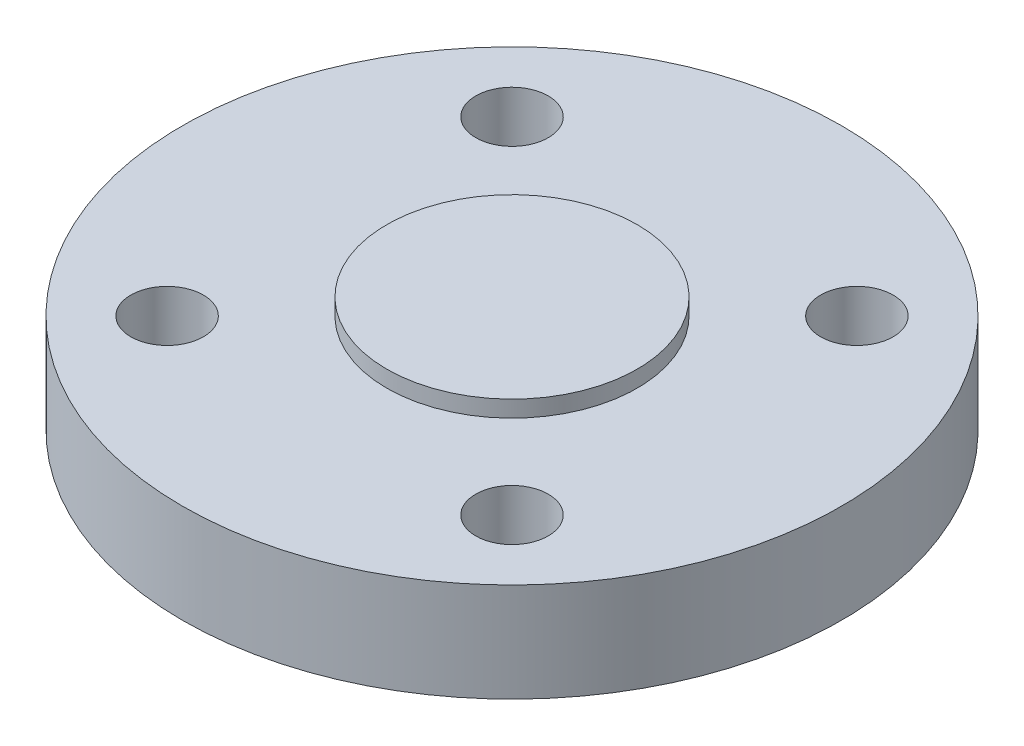
from build123d import *

# Parameters (mm, degrees)
SKETCH_1_R               = 50
EXTRUDE_1_DEPTH          = 15
SKETCH_2_R               = 19
EXTRUDE_2_DEPTH          = 2.5
CUT_EXTRUDE_1_DEPTH      = 73.284161474
CUT_EXTRUDE_1_DEPTH_BACK = 73.284161474
SKETCH_3_R               = 5.5


with BuildPart() as part:
    # 草图1 → 凸台-拉伸1 (new body)
    with BuildSketch(Plane(origin=(0, 0, 0), x_dir=(1, 0, 0), z_dir=(0, 1, 0))):
        with Locations(Location((0, 0, 0), (0, 0, 270))):
            Circle(SKETCH_1_R)
    extrude(amount=EXTRUDE_1_DEPTH)

    # 草图2 → 凸台-拉伸2 (add)
    with BuildSketch(Plane(origin=(0, 15, 0), x_dir=(1, 0, 0), z_dir=(0, 1, 0))):
        with Locations(Location((0, 0, 0), (0, 0, 270))):
            Circle(SKETCH_2_R)
    extrude(amount=EXTRUDE_2_DEPTH)

    # 草图3 → 切除-拉伸1 (cut, two sides: drawn at the far end of the back side and taken through both)
    with BuildSketch(Plane(origin=(0, 15, 0), x_dir=(1, 0, 0), z_dir=(0, 1, 0)).offset(-CUT_EXTRUDE_1_DEPTH_BACK)):
        with Locations(Location((26.162950904, 26.162950904, 0), (0, 0, 270))):
            Circle(SKETCH_3_R)
        with Locations(Location((26.162950904, -26.162950904, 0), (0, 0, 270))):
            Circle(SKETCH_3_R)
        with Locations(Location((-26.162950904, -26.162950904, 0), (0, 0, 270))):
            Circle(SKETCH_3_R)
        with Locations(Location((-26.162950904, 26.162950904, 0), (0, 0, 270))):
            Circle(SKETCH_3_R)
    extrude(amount=CUT_EXTRUDE_1_DEPTH + CUT_EXTRUDE_1_DEPTH_BACK, mode=Mode.SUBTRACT)


solid = part.part
